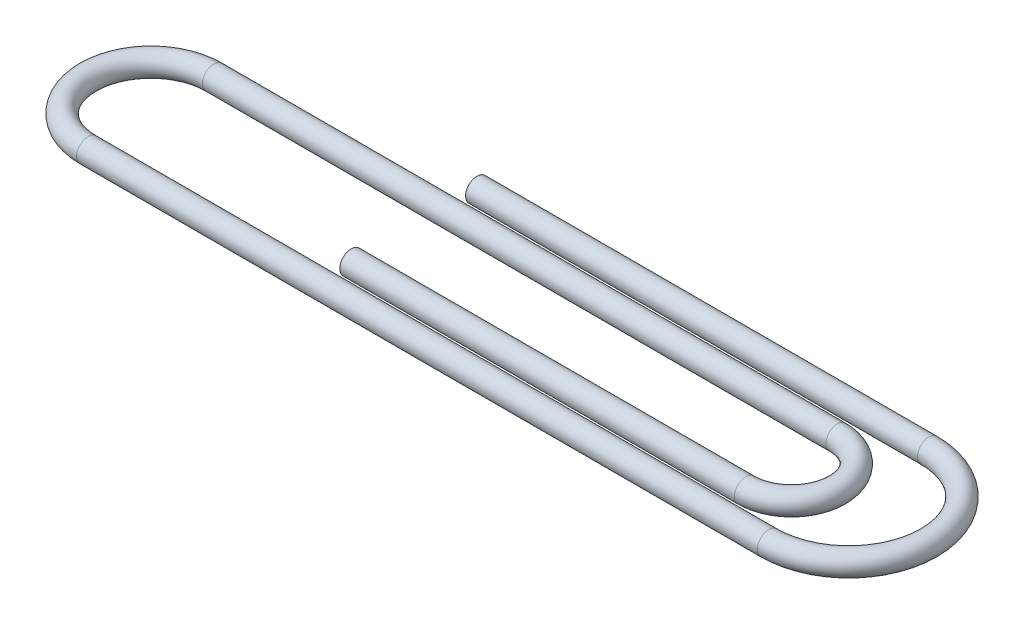
from build123d import *

# Parameters (mm, degrees)
SWEEP1_PROFILE_R = 0.5


with BuildPart() as part:
    # Sweep1: sweep along a path in Sketch1
    with BuildLine(Plane(origin=(0, 0, 0), x_dir=(1, 0, 0), z_dir=(0, 1, 0))) as sweep1_path:
        Line((0, 0), (19.75, 0))
        ThreePointArc((19.75, 0), (23.25, -3.5), (19.75, -7))
        Line((19.75, -7), (-10, -7))
        ThreePointArc((-10, -7), (-12.75, -4.25), (-10, -1.5))
        Line((-10, -1.5), (17.25, -1.5))
        ThreePointArc((17.25, -1.5), (19.25, -3.5), (17.25, -5.5))
        Line((17.25, -5.5), (0, -5.5))
    # Sweep1 profile (on start of the path) → Sweep1 (sweep)
    with BuildSketch(Plane(origin=(0, 0, 0), x_dir=(0, 0, 1), z_dir=(1, 0, 0))):
        Circle(SWEEP1_PROFILE_R)
    sweep(path=sweep1_path.line)


solid = part.part
